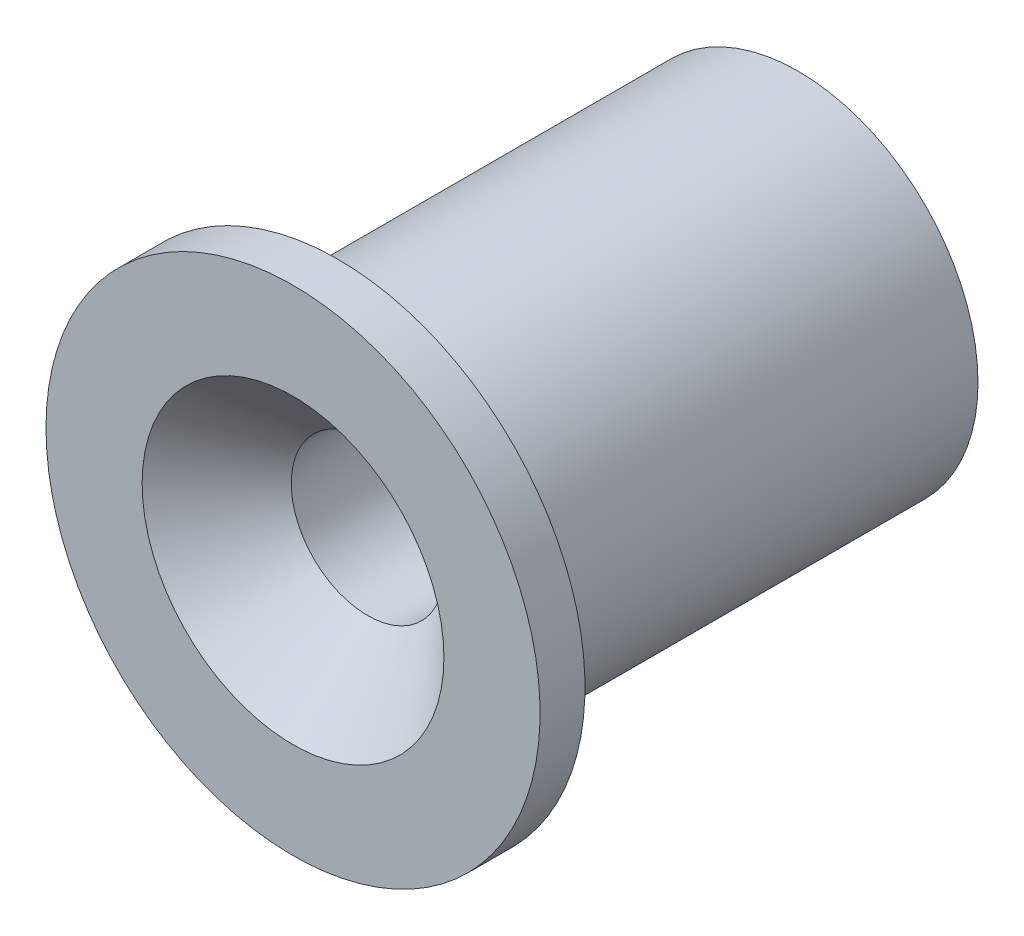
from build123d import *

# Parameters (mm, degrees)
REFRENTADO_PARA_TORNILLO_TAP_N_CON_CABEZ_D           = 3.4
REFRENTADO_PARA_TORNILLO_TAP_N_CON_CABEZ_CSINK_D     = 6.72
REFRENTADO_PARA_TORNILLO_TAP_N_CON_CABEZ_CSINK_ANGLE = 90


with BuildPart() as part:
    # Croquis1 → Revolución1 (revolve)
    with BuildSketch(Plane(origin=(0, 0, 0), x_dir=(1, 0, 0), z_dir=(0, 1, 0))):
        Polygon((-1.5, 11.25), (-1.5, 0), (-5.5, 0), (-5.5, 1), (-4, 1), (-4, 11.25), align=None)
    revolve(axis=Axis((0, 0, -19.14213198), (0, 0, 1)))

    # Refrentado para tornillo tapón con cabeza plana de clavija de M31 (through all)
    with Locations(Plane.XY):
        with Locations((0, 0)):
            CounterSinkHole(REFRENTADO_PARA_TORNILLO_TAP_N_CON_CABEZ_D / 2, REFRENTADO_PARA_TORNILLO_TAP_N_CON_CABEZ_CSINK_D / 2, counter_sink_angle=REFRENTADO_PARA_TORNILLO_TAP_N_CON_CABEZ_CSINK_ANGLE)


solid = part.part
